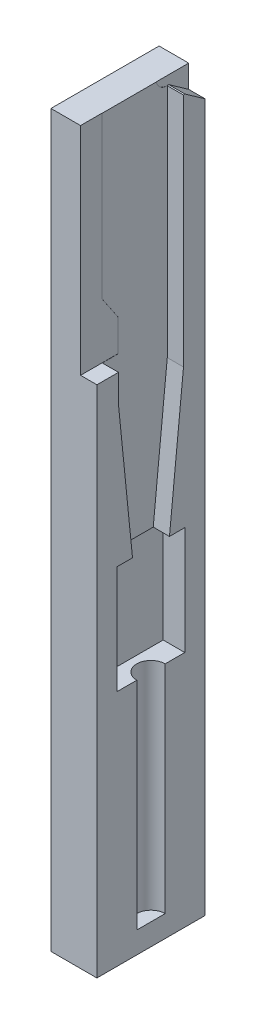
from build123d import *

# Parameters (mm, degrees)
SKETCH_1_W          = 40
SKETCH_1_H          = 270
EXTRUDE_1_DEPTH     = 17
CUT_EXTRUDE_1_DEPTH = 6
SKETCH_3_W          = 152.274191223
SKETCH_3_H          = 354.870754653
CUT_EXTRUDE_2_DEPTH = 272.272925298
SKETCH_5_W          = 16
SKETCH_5_H          = 25
CUT_EXTRUDE_3_DEPTH = 40
SKETCH_6_R          = 5.25
CUT_EXTRUDE_4_DEPTH = 120
CUT_EXTRUDE_5_DEPTH = 6.05


with BuildPart() as part:
    # 스케치1 → 보스-돌출1 (new, symmetric)
    with BuildSketch(Plane(origin=(0, 0, 0), x_dir=(0, 0, -1), z_dir=(1, 0, 0))):
        with Locations((0, -135)):
            Rectangle(SKETCH_1_W, SKETCH_1_H)
    extrude(amount=EXTRUDE_1_DEPTH, both=True)

    # 스케치2 → 컷-돌출1 (cut, symmetric)
    with BuildSketch(Plane(origin=(0, 0, 0), x_dir=(0, 0, -1), z_dir=(1, 0, 0))):
        Polygon((-12.025, 0), (-12.025, -90.319763504), (-6, -150.319763504), (6, -150.319763504), (12.025, -90.319763504), (12.025, 0), align=None)
    extrude(amount=CUT_EXTRUDE_1_DEPTH, both=True, mode=Mode.SUBTRACT)

    # 스케치3 → 컷-돌출2 (cut, through all)
    with BuildSketch(Plane(origin=(0, 0, 0), x_dir=(0, 0, -1), z_dir=(1, 0, 0))):
        with Locations((9.80305952, -151.338432535)):
            Rectangle(SKETCH_3_W, SKETCH_3_H)
    extrude(amount=CUT_EXTRUDE_2_DEPTH, mode=Mode.SUBTRACT)

    # 스케치5 → 컷-돌출3 (cut)
    with BuildSketch(Plane(origin=(0, -142, 0), x_dir=(1, 0, 0), z_dir=(0, 1, 0))):
        Rectangle(SKETCH_5_W, SKETCH_5_H)
    extrude(amount=-CUT_EXTRUDE_3_DEPTH, mode=Mode.SUBTRACT)

    # 스케치6 → 컷-돌출4 (cut)
    with BuildSketch(Plane(origin=(0, -142, 0), x_dir=(1, 0, 0), z_dir=(0, 1, 0))):
        Circle(SKETCH_6_R)
    extrude(amount=-CUT_EXTRUDE_4_DEPTH, mode=Mode.SUBTRACT)

    # 스케치7 → 컷-돌출5 (cut, symmetric)
    with BuildSketch(Plane(origin=(0, 0, 0), x_dir=(0, 0, -1), z_dir=(1, 0, 0))):
        Polygon((-6.155859274, -80), (-36.714111957, -80), (-36.714111957, 2.042704012), (-12.025, 2.042704012), (-12.025, -59.533635609), (-6.155859274, -68.262005046), align=None)
        with BuildLine():
            Line((6.890709855, 1.954718535), (7.897215171, 1.181933858))
            ThreePointArc((7.897215171, 1.181933858), (9.176015746, -2.135086772), (12.576405499, -3.172056537))
            Line((12.576405499, -3.172056537), (24.789660635, -11.787916198))
            Line((24.789660635, -11.787916198), (24.789660635, 1.954718535))
            Line((24.789660635, 1.954718535), (6.890709855, 1.954718535))
        make_face()
    extrude(amount=CUT_EXTRUDE_5_DEPTH, both=True, mode=Mode.SUBTRACT)


solid = part.part
